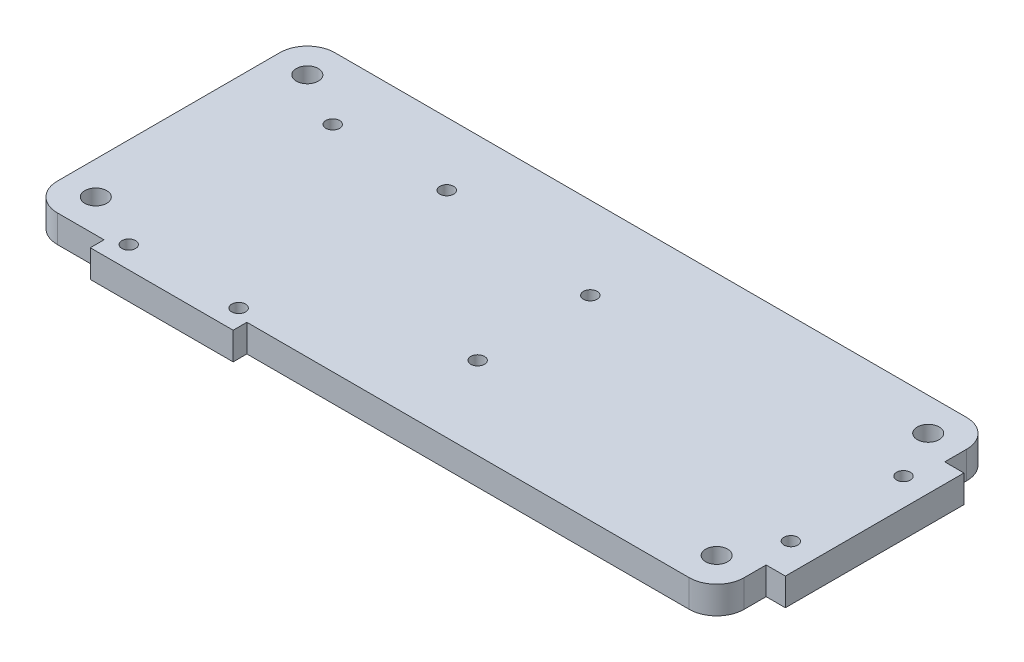
from build123d import *

# Parameters (mm, degrees)
SKETCH1_W           = 125
SKETCH1_H           = 50.5
SKETCH1_R           = 1.25
SKETCH1_R_2         = 2
BOSS_EXTRUDE1_DEPTH = 5
FILLET1_R           = 5
CHAMFER1_SIZE       = 1.5
SKETCH3_W           = 3
SKETCH3_H           = 32.5
SKETCH3_W_2         = 26
SKETCH3_H_2         = 3
BOSS_EXTRUDE2_DEPTH = 5
SKETCH5_W           = 26
SKETCH5_H           = 5
CUT_EXTRUDE1_DEPTH  = 0.5
SKETCH6_W           = 32.5
SKETCH6_H           = 5
BOSS_EXTRUDE4_DEPTH = 0.5


with BuildPart() as part:
    # Sketch1 → Boss-Extrude1 (new body)
    with BuildSketch(Plane(origin=(0, 0, 0), x_dir=(1, 0, 0), z_dir=(0, 1, 0))):
        with Locations((62.5, 25.25)):
            Rectangle(SKETCH1_W, SKETCH1_H)
        with Locations(Location((16.5, 1.5, 0), (0, 0, 270))):
            Circle(SKETCH1_R, mode=Mode.SUBTRACT)
        with Locations(Location((6, 6, 0), (0, 0, 270))):
            Circle(SKETCH1_R_2, mode=Mode.SUBTRACT)
        with Locations(Location((36.5, 1.5, 0), (0, 0, 270))):
            Circle(SKETCH1_R, mode=Mode.SUBTRACT)
        with Locations(Location((119, 6, 0), (0, 0, 270))):
            Circle(SKETCH1_R_2, mode=Mode.SUBTRACT)
        with Locations(Location((16.125, 39, 0), (0, 0, 270))):
            Circle(SKETCH1_R, mode=Mode.SUBTRACT)
        with Locations(Location((6, 44.5, 0), (0, 0, 270))):
            Circle(SKETCH1_R_2, mode=Mode.SUBTRACT)
        with Locations(Location((36.875, 39, 0), (0, 0, 270))):
            Circle(SKETCH1_R, mode=Mode.SUBTRACT)
        with Locations(Location((66.5, 35.5, 0), (0, 0, 270))):
            Circle(SKETCH1_R, mode=Mode.SUBTRACT)
        with Locations(Location((123.5, 35.5, 0), (0, 0, 270))):
            Circle(SKETCH1_R, mode=Mode.SUBTRACT)
        with Locations(Location((66.5, 15, 0), (0, 0, 270))):
            Circle(SKETCH1_R, mode=Mode.SUBTRACT)
        with Locations(Location((123.5, 15, 0), (0, 0, 270))):
            Circle(SKETCH1_R, mode=Mode.SUBTRACT)
        with Locations(Location((119, 44.5, 0), (0, 0, 270))):
            Circle(SKETCH1_R_2, mode=Mode.SUBTRACT)
    extrude(amount=BOSS_EXTRUDE1_DEPTH)

    # Fillet1
    fillet1_edges = [part.edges().sort_by_distance(p)[0] for p in [
        (125, 2.5, 0),
        (0, 2.5, 0),
        (0, 2.5, -50.5),
        (125, 2.5, -50.5),
    ]]
    fillet(fillet1_edges, radius=FILLET1_R)

    # Chamfer1
    chamfer1_edges = [part.edges().sort_by_distance(p)[0] for p in [
        (119, 0, -8),
        (6, 0, -8),
        (6, 0, -46.5),
        (119, 0, -46.5),
    ]]
    chamfer(chamfer1_edges, length=CHAMFER1_SIZE)

    # Sketch3 → Boss-Extrude2 (add)
    with BuildSketch(Plane(origin=(0, 5, 0), x_dir=(1, 0, 0), z_dir=(0, 1, 0))):
        with Locations((126.5, 25.25)):
            Rectangle(SKETCH3_W, SKETCH3_H)
        with Locations((26.5, -1.5)):
            Rectangle(SKETCH3_W_2, SKETCH3_H_2)
    extrude(amount=-BOSS_EXTRUDE2_DEPTH)

    # Sketch5 → Cut-Extrude1 (cut)
    with BuildSketch(Plane.XY.offset(3)):
        with Locations((26.5, 2.5)):
            Rectangle(SKETCH5_W, SKETCH5_H)
    extrude(amount=-CUT_EXTRUDE1_DEPTH, mode=Mode.SUBTRACT)

    # Sketch6 → Boss-Extrude4 (add)
    with BuildSketch(Plane(origin=(128, 0, 0), x_dir=(0, 0, -1), z_dir=(1, 0, 0))):
        with Locations((25.25, 2.5)):
            Rectangle(SKETCH6_W, SKETCH6_H)
    extrude(amount=BOSS_EXTRUDE4_DEPTH)


solid = part.part
